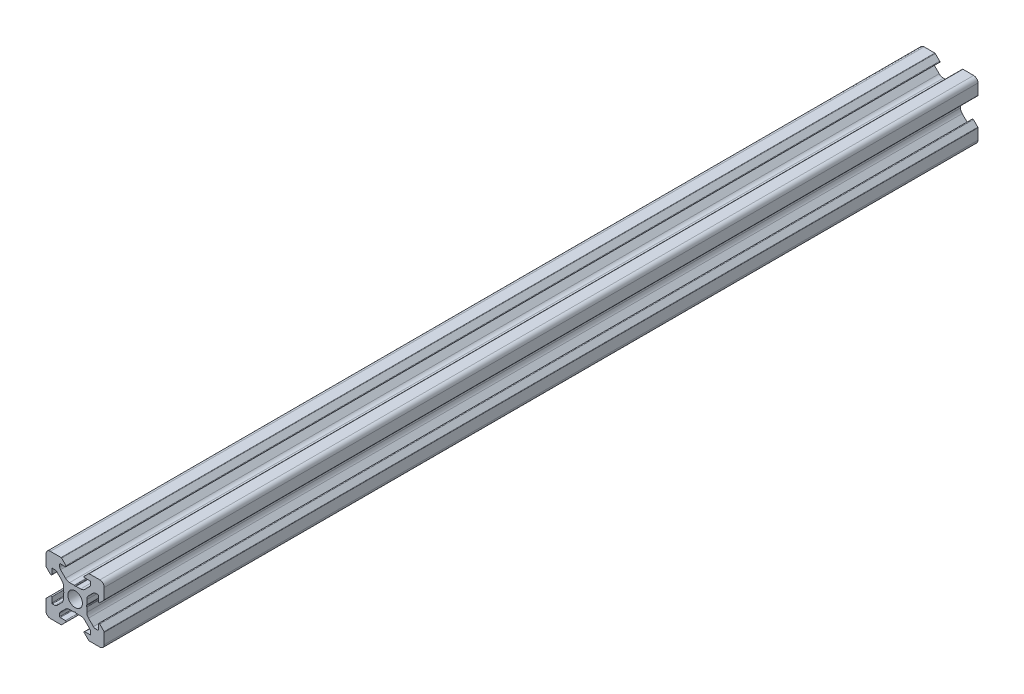
from build123d import *

# Parameters (mm, degrees)
MODEL_R         = 2.5
EXTRUDE_1_DEPTH = 300


with BuildPart() as part:
    # Model → Бобышка-Вытянуть1 (new body)
    with BuildSketch(Plane.XY):
        with BuildLine():
            Line((18.94214915, 33.362214718), (18.94214915, 34.923300122))
            ThreePointArc((18.94214915, 34.923300122), (18.789908215, 35.688666987), (18.356362712, 36.337513684))
            Line((18.356362712, 36.337513684), (16.662250163, 38.031626234))
            ThreePointArc((16.662250163, 38.031626234), (16.337826814, 38.248398985), (15.955143382, 38.324519453))
            Line((15.955143382, 38.324519453), (15.14214915, 38.324519453))
            ThreePointArc((15.14214915, 38.324519453), (15.000727794, 38.265940809), (14.94214915, 38.124519453))
            Line((14.94214915, 38.124519453), (14.94214915, 36.354519453))
            ThreePointArc((14.94214915, 36.354519453), (14.787820008, 36.12354957), (14.515372455, 36.177742757))
            Line((14.515372455, 36.177742757), (13.015372455, 37.677742757))
            ThreePointArc((13.015372455, 37.677742757), (12.961179267, 37.758848595), (12.94214915, 37.854519453))
            Line((12.94214915, 37.854519453), (12.94214915, 41.524519453))
            ThreePointArc((12.94214915, 41.524519453), (13.381488978, 42.585179625), (14.44214915, 43.024519453))
            Line((14.44214915, 43.024519453), (18.11214915, 43.024519453))
            ThreePointArc((18.11214915, 43.024519453), (18.207820008, 43.005489336), (18.288925845, 42.951296148))
            Line((18.288925845, 42.951296148), (19.788925845, 41.451296148))
            ThreePointArc((19.788925845, 41.451296148), (19.843119033, 41.178848595), (19.61214915, 41.024519453))
            Line((19.61214915, 41.024519453), (17.84214915, 41.024519453))
            ThreePointArc((17.84214915, 41.024519453), (17.700727794, 40.965940809), (17.64214915, 40.824519453))
            Line((17.64214915, 40.824519453), (17.64214915, 40.011525221))
            ThreePointArc((17.64214915, 40.011525221), (17.718269617, 39.628841789), (17.935042369, 39.30441844))
            Line((17.935042369, 39.30441844), (19.629154919, 37.61030589))
            ThreePointArc((19.629154919, 37.61030589), (20.278001616, 37.176760388), (21.043368481, 37.024519453))
            Line((21.043368481, 37.024519453), (22.604453885, 37.024519453))
            ThreePointArc((22.604453885, 37.024519453), (22.687205621, 37.010426533), (22.760627647, 36.969736655))
            Line((22.760627647, 36.969736655), (22.94214915, 36.824519453))
            Line((22.94214915, 36.824519453), (23.123670653, 36.969736655))
            ThreePointArc((23.123670653, 36.969736655), (23.197092679, 37.010426533), (23.279844415, 37.024519453))
            Line((23.279844415, 37.024519453), (24.840929819, 37.024519453))
            ThreePointArc((24.840929819, 37.024519453), (25.606296684, 37.176760388), (26.255143382, 37.61030589))
            Line((26.255143382, 37.61030589), (27.949255931, 39.30441844))
            ThreePointArc((27.949255931, 39.30441844), (28.166028683, 39.628841789), (28.24214915, 40.011525221))
            Line((28.24214915, 40.011525221), (28.24214915, 40.824519453))
            ThreePointArc((28.24214915, 40.824519453), (28.183570506, 40.965940809), (28.04214915, 41.024519453))
            Line((28.04214915, 41.024519453), (26.27214915, 41.024519453))
            ThreePointArc((26.27214915, 41.024519453), (26.041179267, 41.178848595), (26.095372455, 41.451296148))
            Line((26.095372455, 41.451296148), (27.595372455, 42.951296148))
            ThreePointArc((27.595372455, 42.951296148), (27.676478292, 43.005489336), (27.77214915, 43.024519453))
            Line((27.77214915, 43.024519453), (31.44214915, 43.024519453))
            ThreePointArc((31.44214915, 43.024519453), (32.502809322, 42.585179625), (32.94214915, 41.524519453))
            Line((32.94214915, 41.524519453), (32.94214915, 37.854519453))
            ThreePointArc((32.94214915, 37.854519453), (32.923119033, 37.758848595), (32.868925845, 37.677742757))
            Line((32.868925845, 37.677742757), (31.368925845, 36.177742757))
            ThreePointArc((31.368925845, 36.177742757), (31.096478292, 36.12354957), (30.94214915, 36.354519453))
            Line((30.94214915, 36.354519453), (30.94214915, 38.124519453))
            ThreePointArc((30.94214915, 38.124519453), (30.883570506, 38.265940809), (30.74214915, 38.324519453))
            Line((30.74214915, 38.324519453), (29.929154919, 38.324519453))
            ThreePointArc((29.929154919, 38.324519453), (29.546471486, 38.248398985), (29.222048137, 38.031626234))
            Line((29.222048137, 38.031626234), (27.527935588, 36.337513684))
            ThreePointArc((27.527935588, 36.337513684), (27.094390085, 35.688666987), (26.94214915, 34.923300122))
            Line((26.94214915, 34.923300122), (26.94214915, 33.362214718))
            ThreePointArc((26.94214915, 33.362214718), (26.92805623, 33.279462982), (26.887366352, 33.206040956))
            Line((26.887366352, 33.206040956), (26.74214915, 33.024519453))
            Line((26.74214915, 33.024519453), (26.887366352, 32.84299795))
            ThreePointArc((26.887366352, 32.84299795), (26.92805623, 32.769575923), (26.94214915, 32.686824188))
            Line((26.94214915, 32.686824188), (26.94214915, 31.125738784))
            ThreePointArc((26.94214915, 31.125738784), (27.094390085, 30.360371919), (27.527935588, 29.711525221))
            Line((27.527935588, 29.711525221), (29.222048137, 28.017412672))
            ThreePointArc((29.222048137, 28.017412672), (29.546471486, 27.80063992), (29.929154919, 27.724519453))
            Line((29.929154919, 27.724519453), (30.74214915, 27.724519453))
            ThreePointArc((30.74214915, 27.724519453), (30.883570506, 27.783098097), (30.94214915, 27.924519453))
            Line((30.94214915, 27.924519453), (30.94214915, 29.694519453))
            ThreePointArc((30.94214915, 29.694519453), (31.096478292, 29.925489336), (31.368925845, 29.871296148))
            Line((31.368925845, 29.871296148), (32.868925845, 28.371296148))
            ThreePointArc((32.868925845, 28.371296148), (32.923119033, 28.290190311), (32.94214915, 28.194519453))
            Line((32.94214915, 28.194519453), (32.94214915, 24.524519453))
            ThreePointArc((32.94214915, 24.524519453), (32.502809322, 23.463859281), (31.44214915, 23.024519453))
            Line((31.44214915, 23.024519453), (27.77214915, 23.024519453))
            ThreePointArc((27.77214915, 23.024519453), (27.676478292, 23.04354957), (27.595372455, 23.097742757))
            Line((27.595372455, 23.097742757), (26.095372455, 24.597742757))
            ThreePointArc((26.095372455, 24.597742757), (26.041179267, 24.870190311), (26.27214915, 25.024519453))
            Line((26.27214915, 25.024519453), (28.04214915, 25.024519453))
            ThreePointArc((28.04214915, 25.024519453), (28.183570506, 25.083098097), (28.24214915, 25.224519453))
            Line((28.24214915, 25.224519453), (28.24214915, 26.037513684))
            ThreePointArc((28.24214915, 26.037513684), (28.166028683, 26.420197117), (27.949255931, 26.744620465))
            Line((27.949255931, 26.744620465), (26.255143382, 28.438733015))
            ThreePointArc((26.255143382, 28.438733015), (25.606296684, 28.872278518), (24.840929819, 29.024519453))
            Line((24.840929819, 29.024519453), (23.279844415, 29.024519453))
            ThreePointArc((23.279844415, 29.024519453), (23.197092679, 29.038612373), (23.123670653, 29.07930225))
            Line((23.123670653, 29.07930225), (22.94214915, 29.224519453))
            Line((22.94214915, 29.224519453), (22.760627647, 29.07930225))
            ThreePointArc((22.760627647, 29.07930225), (22.687205621, 29.038612373), (22.604453885, 29.024519453))
            Line((22.604453885, 29.024519453), (21.043368481, 29.024519453))
            ThreePointArc((21.043368481, 29.024519453), (20.278001616, 28.872278518), (19.629154919, 28.438733015))
            Line((19.629154919, 28.438733015), (17.935042369, 26.744620465))
            ThreePointArc((17.935042369, 26.744620465), (17.718269617, 26.420197117), (17.64214915, 26.037513684))
            Line((17.64214915, 26.037513684), (17.64214915, 25.224519453))
            ThreePointArc((17.64214915, 25.224519453), (17.700727794, 25.083098097), (17.84214915, 25.024519453))
            Line((17.84214915, 25.024519453), (19.61214915, 25.024519453))
            ThreePointArc((19.61214915, 25.024519453), (19.843119033, 24.870190311), (19.788925845, 24.597742757))
            Line((19.788925845, 24.597742757), (18.288925845, 23.097742757))
            ThreePointArc((18.288925845, 23.097742757), (18.207820008, 23.04354957), (18.11214915, 23.024519453))
            Line((18.11214915, 23.024519453), (14.44214915, 23.024519453))
            ThreePointArc((14.44214915, 23.024519453), (13.381488978, 23.463859281), (12.94214915, 24.524519453))
            Line((12.94214915, 24.524519453), (12.94214915, 28.194519453))
            ThreePointArc((12.94214915, 28.194519453), (12.961179267, 28.290190311), (13.015372455, 28.371296148))
            Line((13.015372455, 28.371296148), (14.515372455, 29.871296148))
            ThreePointArc((14.515372455, 29.871296148), (14.787820008, 29.925489336), (14.94214915, 29.694519453))
            Line((14.94214915, 29.694519453), (14.94214915, 27.924519453))
            ThreePointArc((14.94214915, 27.924519453), (15.000727794, 27.783098097), (15.14214915, 27.724519453))
            Line((15.14214915, 27.724519453), (15.955143382, 27.724519453))
            ThreePointArc((15.955143382, 27.724519453), (16.337826814, 27.80063992), (16.662250163, 28.017412672))
            Line((16.662250163, 28.017412672), (18.356362712, 29.711525221))
            ThreePointArc((18.356362712, 29.711525221), (18.789908215, 30.360371919), (18.94214915, 31.125738784))
            Line((18.94214915, 31.125738784), (18.94214915, 32.686824188))
            ThreePointArc((18.94214915, 32.686824188), (18.95624207, 32.769575923), (18.996931948, 32.84299795))
            Line((18.996931948, 32.84299795), (19.14214915, 33.024519453))
            Line((19.14214915, 33.024519453), (18.996931948, 33.206040956))
            ThreePointArc((18.996931948, 33.206040956), (18.95624207, 33.279462982), (18.94214915, 33.362214718))
        make_face()
        with Locations((22.94214915, 33.024519453)):
            Circle(MODEL_R, mode=Mode.SUBTRACT)
    extrude(amount=EXTRUDE_1_DEPTH)


solid = part.part
